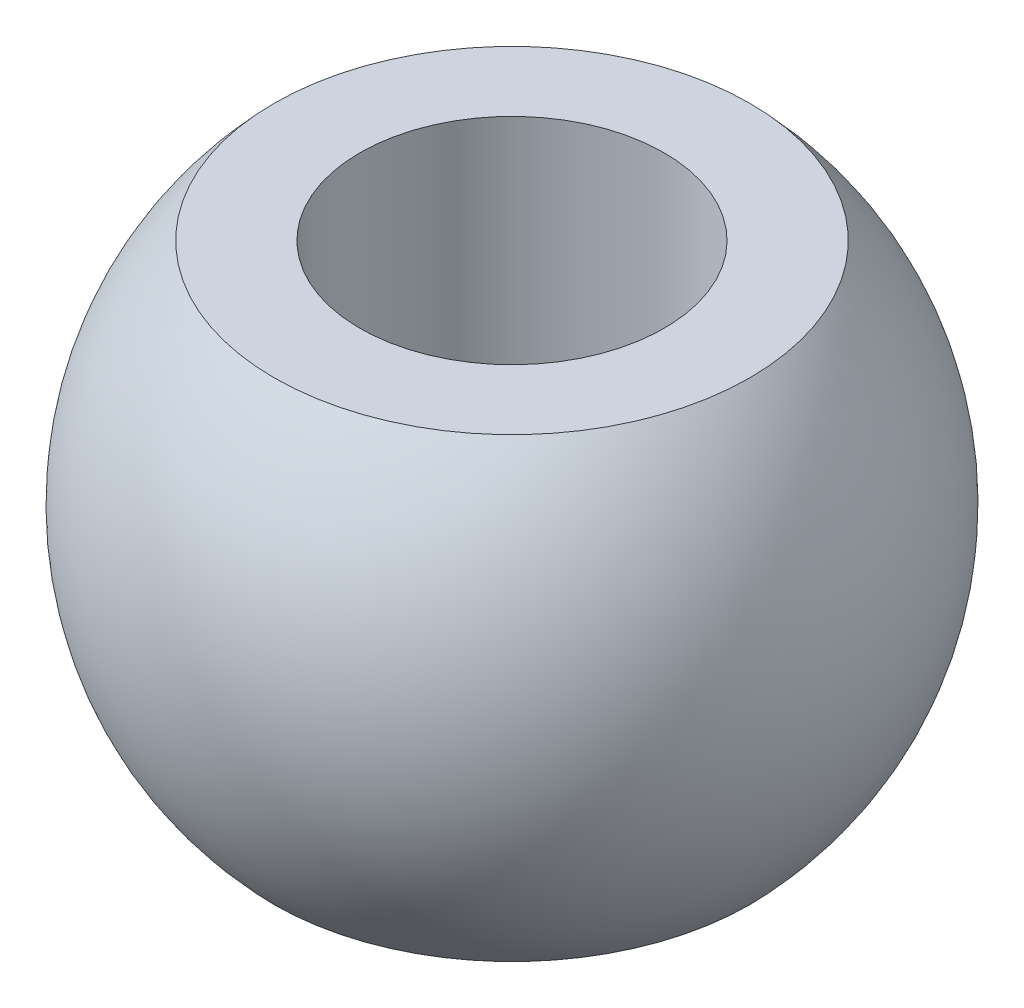
from build123d import *

# Parameters (mm, degrees)
SKETCH_2_R          = 3
CUT_EXTRUDE_1_DEPTH = 13.86468033


with BuildPart() as part:
    # 草图1 → 旋转2 (revolve)
    with BuildSketch(Plane.XY):
        with BuildLine():
            Line((0, 4.5), (4.69041576, 4.5))
            ThreePointArc((4.69041576, 4.5), (6.5, 0), (4.69041576, -4.5))
            Line((4.69041576, -4.5), (0, -4.5))
            Line((0, -4.5), (0, 4.5))
        make_face()
    revolve(axis=Axis((0, 4.5, 0), (0, -1, 0)))

    # 草图2 → 切除-拉伸1 (cut, through all)
    with BuildSketch(Plane(origin=(0, 4.5, 0), x_dir=(1, 0, 0), z_dir=(0, 1, 0))):
        with Locations(Location((0, 0, 0), (0, 0, 180))):
            Circle(SKETCH_2_R)
    extrude(amount=-CUT_EXTRUDE_1_DEPTH, mode=Mode.SUBTRACT)


solid = part.part
